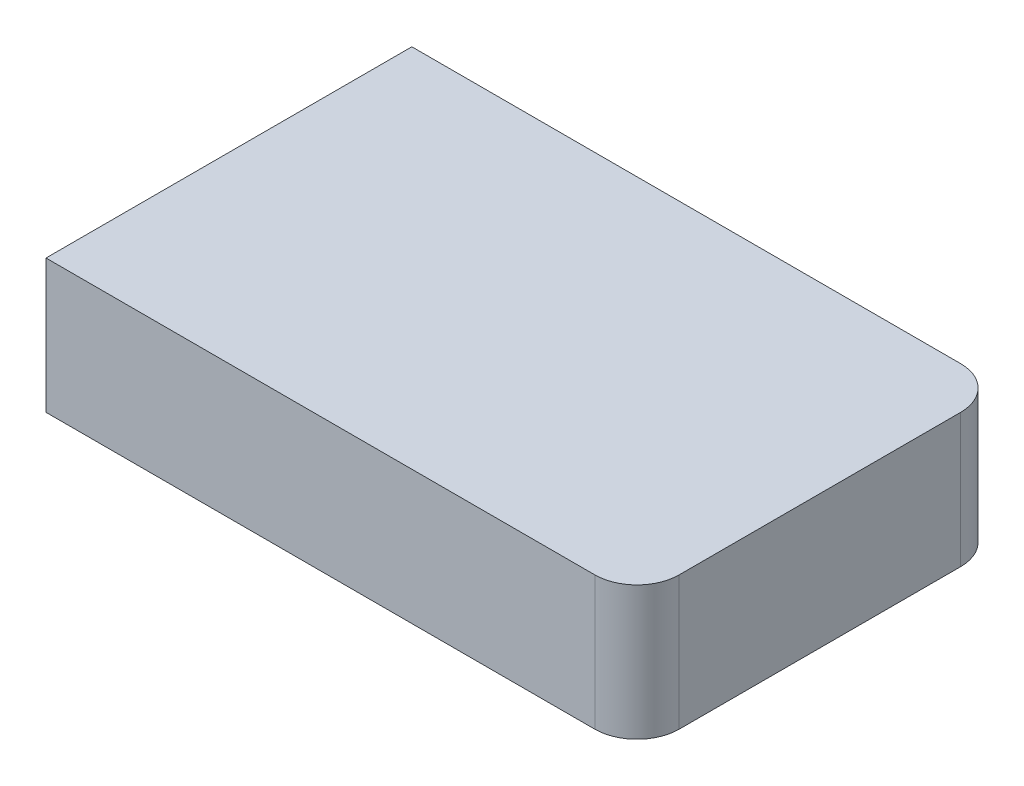
from build123d import *

# Parameters (mm, degrees)
SKETCH_1_W      = 42
SKETCH_1_H      = 26
EXTRUDE_1_DEPTH = 9.5
FILLET_1_R      = 3


with BuildPart() as part:
    # 草图1 → 凸台-拉伸1 (new body)
    with BuildSketch(Plane(origin=(0, 0, 0), x_dir=(1, 0, 0), z_dir=(0, 1, 0))):
        Rectangle(SKETCH_1_W, SKETCH_1_H)
    extrude(amount=EXTRUDE_1_DEPTH)

    # 圆角1
    fillet_1_edges = [part.edges().sort_by_distance(p)[0] for p in [
        (21, 4.75, 13),
        (21, 4.75, -13),
    ]]
    fillet(fillet_1_edges, radius=FILLET_1_R)


solid = part.part
